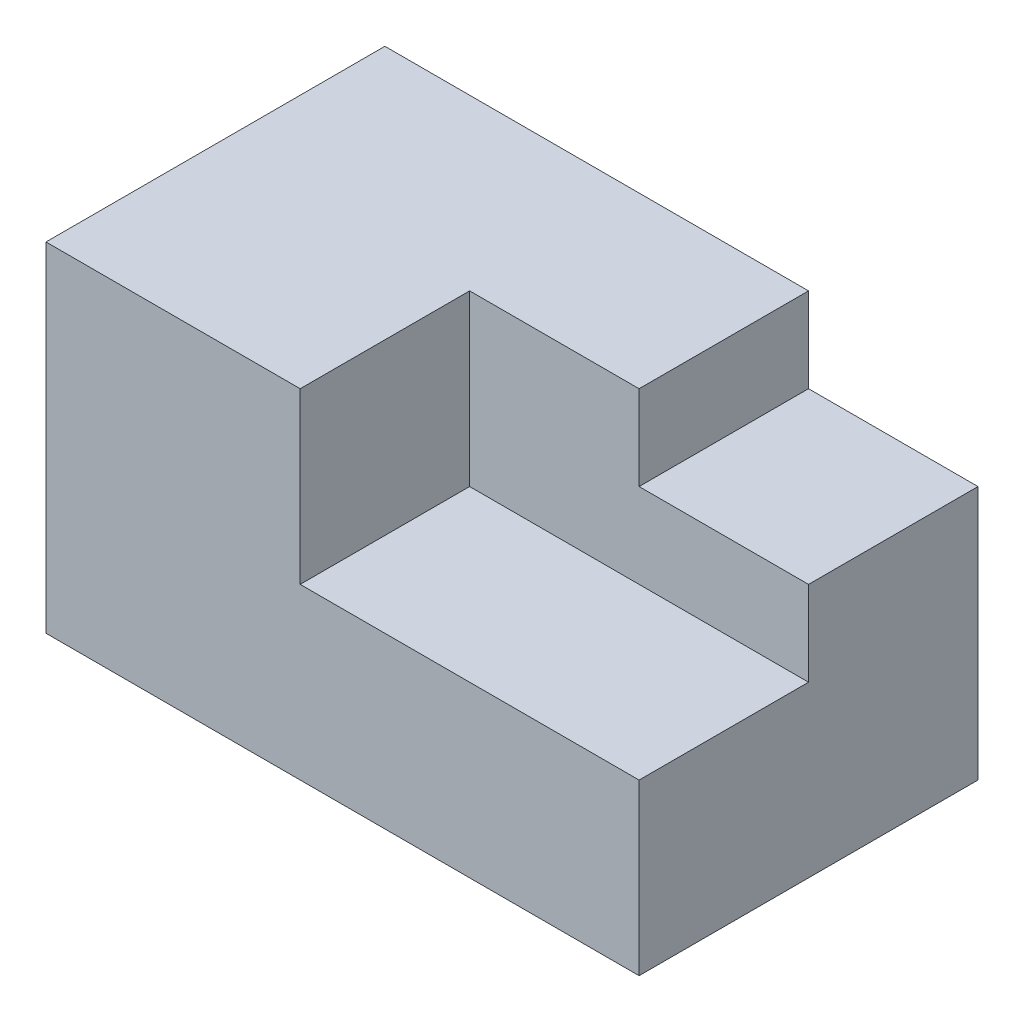
from build123d import *

# Parameters (mm, degrees)
SKETCH_1_W          = 70
SKETCH_1_H          = 40
EXTRUDE_1_DEPTH     = 40
SKETCH_2_W          = 20
SKETCH_2_H          = 20
CUT_EXTRUDE_1_DEPTH = 10
SKETCH_3_W          = 40
SKETCH_3_H          = 20
CUT_EXTRUDE_2_DEPTH = 20


with BuildPart() as part:
    # 스케치1 → 보스-돌출1 (new body)
    with BuildSketch(Plane(origin=(0, 0, 0), x_dir=(1, 0, 0), z_dir=(0, 1, 0))):
        with Locations((35, 20)):
            Rectangle(SKETCH_1_W, SKETCH_1_H)
    extrude(amount=EXTRUDE_1_DEPTH)

    # 스케치2 → 컷-돌출1 (cut)
    with BuildSketch(Plane(origin=(0, 40, 0), x_dir=(1, 0, 0), z_dir=(0, 1, 0))):
        with Locations((60, 30)):
            Rectangle(SKETCH_2_W, SKETCH_2_H)
    extrude(amount=-CUT_EXTRUDE_1_DEPTH, mode=Mode.SUBTRACT)

    # 스케치3 → 컷-돌출2 (cut)
    with BuildSketch(Plane(origin=(0, 40, 0), x_dir=(1, 0, 0), z_dir=(0, 1, 0))):
        with Locations((50, 10)):
            Rectangle(SKETCH_3_W, SKETCH_3_H)
    extrude(amount=-CUT_EXTRUDE_2_DEPTH, mode=Mode.SUBTRACT)


solid = part.part
